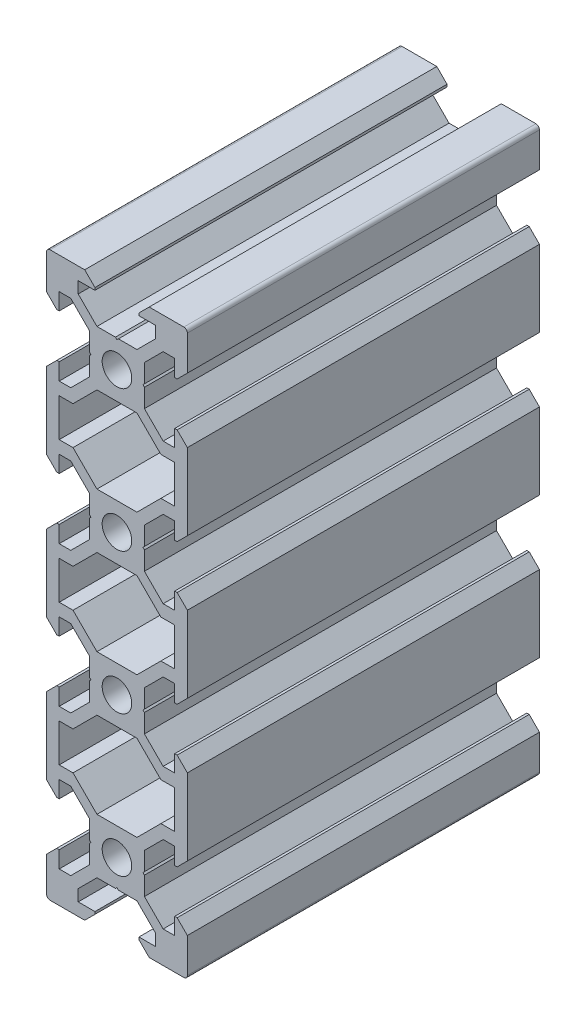
from build123d import *

# Parameters (mm, degrees)
SKETCH1_R           = 2.1
BOSS_EXTRUDE1_DEPTH = 50


with BuildPart() as part:
    # Sketch1 → Boss-Extrude1 (new body)
    with BuildSketch(Plane.XY):
        with BuildLine():
            Line((4.58, -40), (9.5, -40))
            ThreePointArc((9.5, -40), (9.853553391, -39.853553391), (10, -39.5))
            Line((10, -39.5), (10, -34.58))
            Line((10, -34.58), (8.545, -33.125))
            Line((8.545, -33.125), (8.2, -33.125))
            Line((8.2, -33.125), (8.2, -35.5))
            Line((8.2, -35.5), (6.560660172, -35.5))
            Line((6.560660172, -35.5), (3.9, -32.839339828))
            Line((3.9, -32.839339828), (3.9, -30.21))
            Line((3.9, -30.21), (3.69, -30))
            Line((3.69, -30), (3.9, -29.79))
            Line((3.9, -29.79), (3.9, -27.160660172))
            Line((3.9, -27.160660172), (6.560660172, -24.5))
            Line((6.560660172, -24.5), (8.2, -24.5))
            Line((8.2, -24.5), (8.2, -26.875))
            Line((8.2, -26.875), (8.545, -26.875))
            Line((8.545, -26.875), (10, -25.42))
            Line((10, -25.42), (10, -14.58))
            Line((10, -14.58), (8.545, -13.125))
            Line((8.545, -13.125), (8.2, -13.125))
            Line((8.2, -13.125), (8.2, -15.5))
            Line((8.2, -15.5), (6.560660172, -15.5))
            Line((6.560660172, -15.5), (3.9, -12.839339828))
            Line((3.9, -12.839339828), (3.9, -10.21))
            Line((3.9, -10.21), (3.69, -10))
            Line((3.69, -10), (3.9, -9.79))
            Line((3.9, -9.79), (3.9, -7.160660172))
            Line((3.9, -7.160660172), (6.560660172, -4.5))
            Line((6.560660172, -4.5), (8.2, -4.5))
            Line((8.2, -4.5), (8.2, -6.875))
            Line((8.2, -6.875), (8.545, -6.875))
            Line((8.545, -6.875), (10, -5.42))
            Line((10, -5.42), (10, 5.42))
            Line((10, 5.42), (8.545, 6.875))
            Line((8.545, 6.875), (8.2, 6.875))
            Line((8.2, 6.875), (8.2, 4.5))
            Line((8.2, 4.5), (6.560660172, 4.5))
            Line((6.560660172, 4.5), (3.9, 7.160660172))
            Line((3.9, 7.160660172), (3.9, 9.79))
            Line((3.9, 9.79), (3.69, 10))
            Line((3.69, 10), (3.9, 10.21))
            Line((3.9, 10.21), (3.9, 12.839339828))
            Line((3.9, 12.839339828), (6.560660172, 15.5))
            Line((6.560660172, 15.5), (8.2, 15.5))
            Line((8.2, 15.5), (8.2, 13.125))
            Line((8.2, 13.125), (8.545, 13.125))
            Line((8.545, 13.125), (10, 14.58))
            Line((10, 14.58), (10, 25.42))
            Line((10, 25.42), (8.545, 26.875))
            Line((8.545, 26.875), (8.2, 26.875))
            Line((8.2, 26.875), (8.2, 24.5))
            Line((8.2, 24.5), (6.560660172, 24.5))
            Line((6.560660172, 24.5), (3.9, 27.160660172))
            Line((3.9, 27.160660172), (3.9, 29.79))
            Line((3.9, 29.79), (3.69, 30))
            Line((3.69, 30), (3.9, 30.21))
            Line((3.9, 30.21), (3.9, 32.839339828))
            Line((3.9, 32.839339828), (6.560660172, 35.5))
            Line((6.560660172, 35.5), (8.2, 35.5))
            Line((8.2, 35.5), (8.2, 33.125))
            Line((8.2, 33.125), (8.545, 33.125))
            Line((8.545, 33.125), (10, 34.58))
            Line((10, 34.58), (10, 39.5))
            ThreePointArc((10, 39.5), (9.853553391, 39.853553391), (9.5, 40))
            Line((9.5, 40), (4.58, 40))
            Line((4.58, 40), (3.125, 38.545))
            Line((3.125, 38.545), (3.125, 38.2))
            Line((3.125, 38.2), (5.5, 38.2))
            Line((5.5, 38.2), (5.5, 36.560660172))
            Line((5.5, 36.560660172), (2.839339828, 33.9))
            Line((2.839339828, 33.9), (0.21, 33.9))
            Line((0.21, 33.9), (0, 33.69))
            Line((0, 33.69), (-0.21, 33.9))
            Line((-0.21, 33.9), (-2.839339828, 33.9))
            Line((-2.839339828, 33.9), (-5.5, 36.560660172))
            Line((-5.5, 36.560660172), (-5.5, 38.2))
            Line((-5.5, 38.2), (-3.125, 38.2))
            Line((-3.125, 38.2), (-3.125, 38.545))
            Line((-3.125, 38.545), (-4.58, 40))
            Line((-4.58, 40), (-9.5, 40))
            ThreePointArc((-9.5, 40), (-9.853553391, 39.853553391), (-10, 39.5))
            Line((-10, 39.5), (-10, 34.58))
            Line((-10, 34.58), (-8.545, 33.125))
            Line((-8.545, 33.125), (-8.2, 33.125))
            Line((-8.2, 33.125), (-8.2, 35.5))
            Line((-8.2, 35.5), (-6.560660172, 35.5))
            Line((-6.560660172, 35.5), (-3.9, 32.839339828))
            Line((-3.9, 32.839339828), (-3.9, 30.21))
            Line((-3.9, 30.21), (-3.69, 30))
            Line((-3.69, 30), (-3.9, 29.79))
            Line((-3.9, 29.79), (-3.9, 27.160660172))
            Line((-3.9, 27.160660172), (-6.560660172, 24.5))
            Line((-6.560660172, 24.5), (-8.2, 24.5))
            Line((-8.2, 24.5), (-8.2, 26.875))
            Line((-8.2, 26.875), (-8.545, 26.875))
            Line((-8.545, 26.875), (-10, 25.42))
            Line((-10, 25.42), (-10, 14.58))
            Line((-10, 14.58), (-8.545, 13.125))
            Line((-8.545, 13.125), (-8.2, 13.125))
            Line((-8.2, 13.125), (-8.2, 15.5))
            Line((-8.2, 15.5), (-6.560660172, 15.5))
            Line((-6.560660172, 15.5), (-3.9, 12.839339828))
            Line((-3.9, 12.839339828), (-3.9, 10.21))
            Line((-3.9, 10.21), (-3.69, 10))
            Line((-3.69, 10), (-3.9, 9.79))
            Line((-3.9, 9.79), (-3.9, 7.160660172))
            Line((-3.9, 7.160660172), (-6.560660172, 4.5))
            Line((-6.560660172, 4.5), (-8.2, 4.5))
            Line((-8.2, 4.5), (-8.2, 6.875))
            Line((-8.2, 6.875), (-8.545, 6.875))
            Line((-8.545, 6.875), (-10, 5.42))
            Line((-10, 5.42), (-10, -5.42))
            Line((-10, -5.42), (-8.545, -6.875))
            Line((-8.545, -6.875), (-8.2, -6.875))
            Line((-8.2, -6.875), (-8.2, -4.5))
            Line((-8.2, -4.5), (-6.560660172, -4.5))
            Line((-6.560660172, -4.5), (-3.9, -7.160660172))
            Line((-3.9, -7.160660172), (-3.9, -9.79))
            Line((-3.9, -9.79), (-3.69, -10))
            Line((-3.69, -10), (-3.9, -10.21))
            Line((-3.9, -10.21), (-3.9, -12.839339828))
            Line((-3.9, -12.839339828), (-6.560660172, -15.5))
            Line((-6.560660172, -15.5), (-8.2, -15.5))
            Line((-8.2, -15.5), (-8.2, -13.125))
            Line((-8.2, -13.125), (-8.545, -13.125))
            Line((-8.545, -13.125), (-10, -14.58))
            Line((-10, -14.58), (-10, -25.42))
            Line((-10, -25.42), (-8.545, -26.875))
            Line((-8.545, -26.875), (-8.2, -26.875))
            Line((-8.2, -26.875), (-8.2, -24.5))
            Line((-8.2, -24.5), (-6.560660172, -24.5))
            Line((-6.560660172, -24.5), (-3.9, -27.160660172))
            Line((-3.9, -27.160660172), (-3.9, -29.79))
            Line((-3.9, -29.79), (-3.69, -30))
            Line((-3.69, -30), (-3.9, -30.21))
            Line((-3.9, -30.21), (-3.9, -32.839339828))
            Line((-3.9, -32.839339828), (-6.560660172, -35.5))
            Line((-6.560660172, -35.5), (-8.2, -35.5))
            Line((-8.2, -35.5), (-8.2, -33.125))
            Line((-8.2, -33.125), (-8.545, -33.125))
            Line((-8.545, -33.125), (-10, -34.58))
            Line((-10, -34.58), (-10, -39.5))
            ThreePointArc((-10, -39.5), (-9.853553391, -39.853553391), (-9.5, -40))
            Line((-9.5, -40), (-4.58, -40))
            Line((-4.58, -40), (-3.125, -38.545))
            Line((-3.125, -38.545), (-3.125, -38.2))
            Line((-3.125, -38.2), (-5.5, -38.2))
            Line((-5.5, -38.2), (-5.5, -36.560660172))
            Line((-5.5, -36.560660172), (-2.839339828, -33.9))
            Line((-2.839339828, -33.9), (-0.21, -33.9))
            Line((-0.21, -33.9), (0, -33.69))
            Line((0, -33.69), (0.21, -33.9))
            Line((0.21, -33.9), (2.839339828, -33.9))
            Line((2.839339828, -33.9), (5.5, -36.560660172))
            Line((5.5, -36.560660172), (5.5, -38.2))
            Line((5.5, -38.2), (3.125, -38.2))
            Line((3.125, -38.2), (3.125, -38.545))
            Line((3.125, -38.545), (4.58, -40))
        make_face()
        with Locations((0, -30)):
            Circle(SKETCH1_R, mode=Mode.SUBTRACT)
        Polygon((-6.239339828, -22.7), (-8.2, -22.7), (-8.2, -17.3), (-6.239339828, -17.3), (-2.839339828, -13.9), (2.839339828, -13.9), (6.239339828, -17.3), (8.2, -17.3), (8.2, -22.7), (6.239339828, -22.7), (2.839339828, -26.1), (-2.839339828, -26.1), align=None, mode=Mode.SUBTRACT)
        with Locations((0, -10)):
            Circle(SKETCH1_R, mode=Mode.SUBTRACT)
        Polygon((-6.239339828, -2.7), (-8.2, -2.7), (-8.2, 2.7), (-6.239339828, 2.7), (-2.839339828, 6.1), (2.839339828, 6.1), (6.239339828, 2.7), (8.2, 2.7), (8.2, -2.7), (6.239339828, -2.7), (2.839339828, -6.1), (-2.839339828, -6.1), align=None, mode=Mode.SUBTRACT)
        with Locations((0, 10)):
            Circle(SKETCH1_R, mode=Mode.SUBTRACT)
        Polygon((-6.239339828, 17.3), (-8.2, 17.3), (-8.2, 22.7), (-6.239339828, 22.7), (-2.839339828, 26.1), (2.839339828, 26.1), (6.239339828, 22.7), (8.2, 22.7), (8.2, 17.3), (6.239339828, 17.3), (2.839339828, 13.9), (-2.839339828, 13.9), align=None, mode=Mode.SUBTRACT)
        with Locations((0, 30)):
            Circle(SKETCH1_R, mode=Mode.SUBTRACT)
    extrude(amount=BOSS_EXTRUDE1_DEPTH)


solid = part.part
